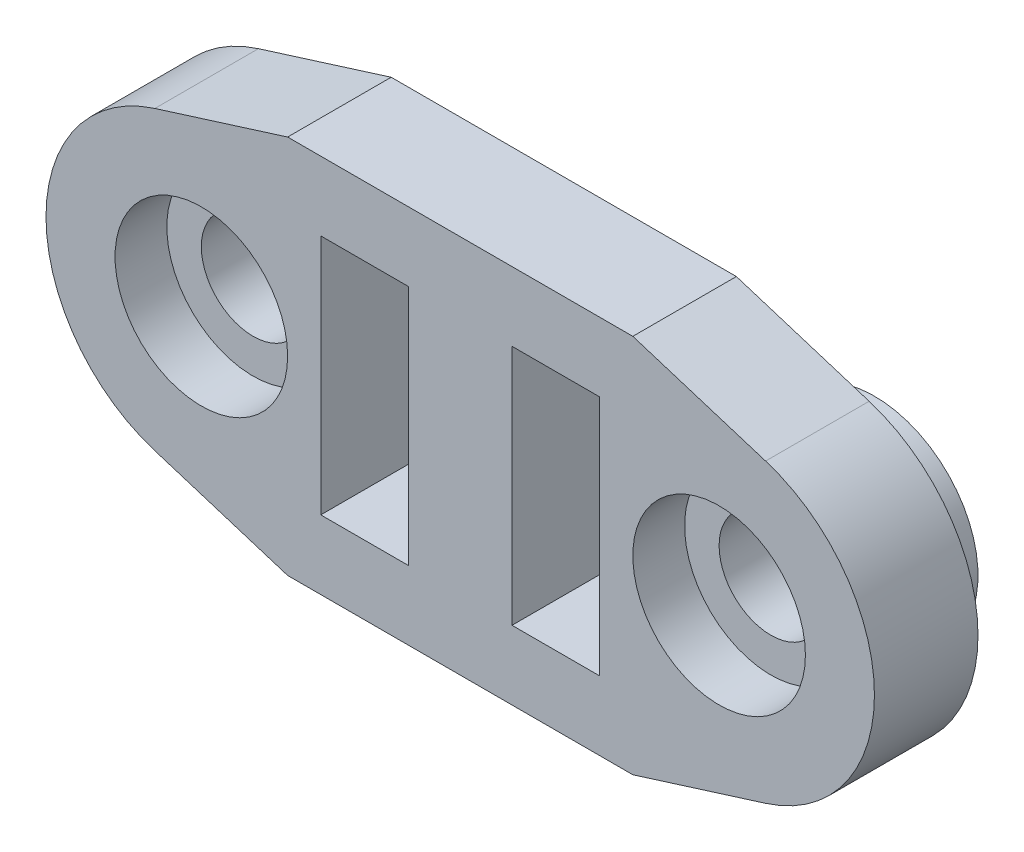
from build123d import *
from build123d.topology import SkipClean

# Parameters (mm, degrees)
SKETCH1_R           = 1.5
BOSS_EXTRUDE1_DEPTH = 1.5
BOSS_EXTRUDE2_START = 1.5
SKETCH2_R           = 3
SKETCH2_R_2         = 1.5
BOSS_EXTRUDE2_DEPTH = 1.5
SKETCH3_R           = 2.5
CUT_EXTRUDE1_DEPTH  = 1.5
SKETCH4_W           = 2.54
SKETCH4_H           = 7
CUT_EXTRUDE2_DEPTH  = 14.946325681


with BuildPart() as part:
    # Sketch1 → Boss-Extrude1 (new, symmetric)
    with BuildSketch(Plane.XY):
        with BuildLine():
            Line((-5, 5.5), (5, 5.5))
            Line((5, 5.5), (8.846450401, 4.293841091))
            ThreePointArc((8.846450401, 4.293841091), (12, 0), (8.846450401, -4.293841091))
            Line((8.846450401, -4.293841091), (5, -5.5))
            Line((5, -5.5), (-5, -5.5))
            Line((-5, -5.5), (-8.846450401, -4.293841091))
            ThreePointArc((-8.846450401, -4.293841091), (-12, 0), (-8.846450401, 4.293841091))
            Line((-8.846450401, 4.293841091), (-5, 5.5))
        make_face()
        with Locations((-7.5, 0)):
            Circle(SKETCH1_R, mode=Mode.SUBTRACT)
        with Locations((7.5, 0)):
            Circle(SKETCH1_R, mode=Mode.SUBTRACT)
    extrude(amount=BOSS_EXTRUDE1_DEPTH, both=True)

    # Sketch2 → Boss-Extrude2 (add)
    # profile 1 of 2: a face of its own
    with SkipClean():  # the faces are left unmerged after this step: merging them gives an invalid solid
        with BuildSketch(Plane(origin=(0, 0, -1.5), x_dir=(-1, 0, 0), z_dir=(0, 0, -1)).offset(BOSS_EXTRUDE2_START)):
            with Locations((-7.5, 0)):
                Circle(SKETCH2_R)
            with Locations((-7.5, 0)):
                Circle(SKETCH2_R_2, mode=Mode.SUBTRACT)
        # profile 2 of 2: a face of its own
        with BuildSketch(Plane(origin=(0, 0, -1.5), x_dir=(-1, 0, 0), z_dir=(0, 0, -1)).offset(BOSS_EXTRUDE2_START)):
            with Locations((7.5, 0)):
                Circle(SKETCH2_R)
            with Locations((7.5, 0)):
                Circle(SKETCH2_R_2, mode=Mode.SUBTRACT)
        extrude(amount=-BOSS_EXTRUDE2_DEPTH)

    # Sketch3 → Cut-Extrude1 (cut)
    with BuildSketch(Plane.XY.offset(1.5)):
        with Locations((-7.5, 0)):
            Circle(SKETCH3_R)
        with Locations((7.5, 0)):
            Circle(SKETCH3_R)
    extrude(amount=-CUT_EXTRUDE1_DEPTH, mode=Mode.SUBTRACT)

    # Sketch4 → Cut-Extrude2 (cut, through all)
    with BuildSketch(Plane.XY.offset(1.5)):
        with Locations((-2.77, 0)):
            Rectangle(SKETCH4_W, SKETCH4_H)
        with Locations((2.77, 0)):
            Rectangle(SKETCH4_W, SKETCH4_H)
    extrude(amount=-CUT_EXTRUDE2_DEPTH, mode=Mode.SUBTRACT)


solid = part.part
